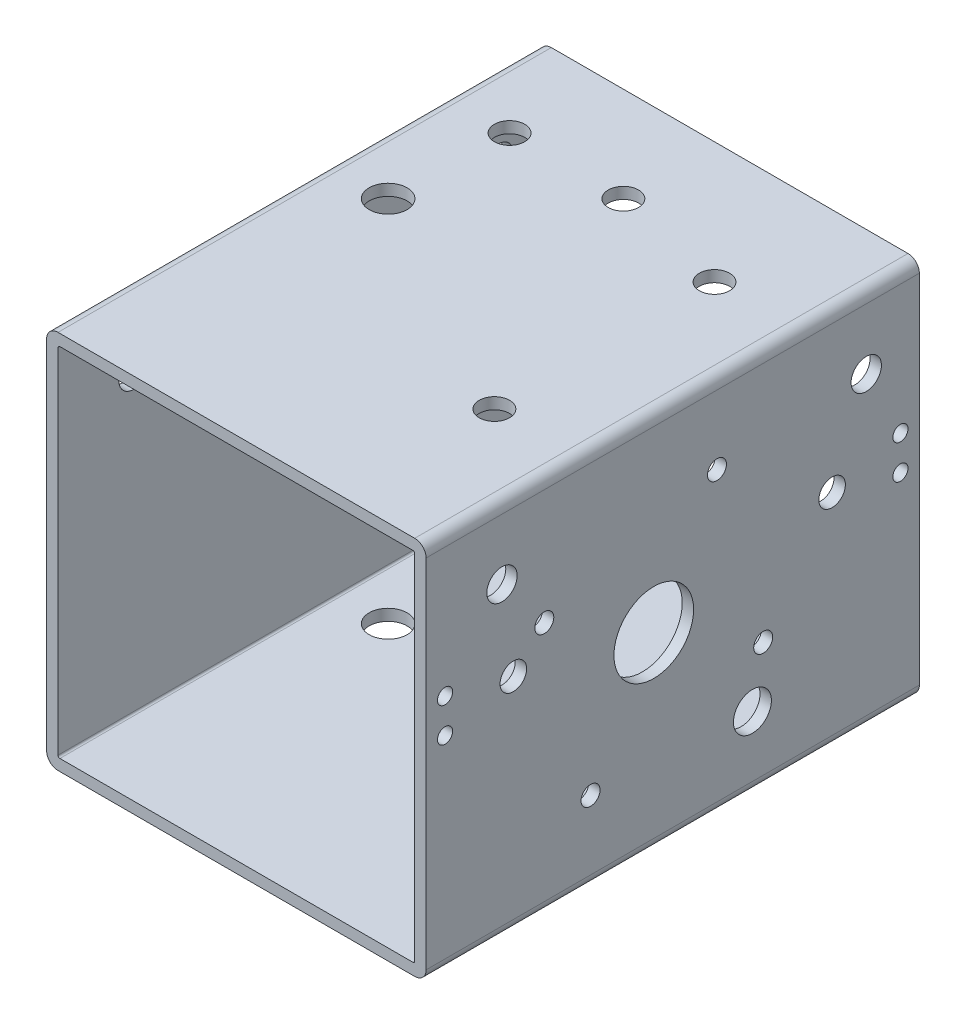
from build123d import *

# Parameters (mm, degrees)
SKETCH1_W                      = 100
SKETCH1_H                      = 100
SKETCH1_W_2                    = 94
SKETCH1_H_2                    = 94
EXTRUDE_THIN1_DEPTH            = 130
FILLET1_R                      = 0.5
FILLET2_R                      = 3
F_8_0_8_DIAMETER_HOLE2_D       = 8
F_8_0_8_DIAMETER_HOLE3_D       = 8
F_10_0_10_DIAMETER_HOLE1_D     = 10
F_10_0_10_DIAMETER_HOLE2_D     = 10
F_6_0_6_DIAMETER_HOLE1_D       = 6
F_6_0_6_DIAMETER_HOLE1_DEPTH   = 3
F_6_0_6_DIAMETER_HOLE2_D       = 6
F_6_0_6_DIAMETER_HOLE2_DEPTH   = 3
F_21_0_21_DIAMETER_HOLE1_D     = 21
F_21_0_21_DIAMETER_HOLE1_DEPTH = 3
F_5_0_5_DIAMETER_HOLE1_D       = 5
F_5_0_5_DIAMETER_HOLE1_DEPTH   = 3
F_8_0_8_DIAMETER_HOLE4_D       = 8
F_8_0_8_DIAMETER_HOLE4_DEPTH   = 3
CUT_EXTRUDE1_REACH             = 173.464
SKETCH31_R                     = 2
SKETCH31_R_2                   = 3.5
F_8_0_8_DIAMETER_HOLE5_D       = 8
F_8_0_8_DIAMETER_HOLE5_DEPTH   = 3


with BuildPart() as part:
    # Sketch1 → Extrude-Thin1 (new body)
    with BuildSketch(Plane.XY):
        Rectangle(SKETCH1_W, SKETCH1_H)
        Rectangle(SKETCH1_W_2, SKETCH1_H_2, mode=Mode.SUBTRACT)
    extrude(amount=EXTRUDE_THIN1_DEPTH)

    # Fillet1
    fillet1_edges = [part.edges().sort_by_distance(p)[0] for p in [
        (47, -47, 65),
        (47, 47, 65),
        (-47, 47, 65),
        (-47, -47, 65),
    ]]
    fillet(fillet1_edges, radius=FILLET1_R)

    # Fillet2
    fillet2_edges = [part.edges().sort_by_distance(p)[0] for p in [
        (50, -50, 65),
        (-50, -50, 65),
        (-50, 50, 65),
        (50, 50, 65),
    ]]
    fillet(fillet2_edges, radius=FILLET2_R)

    # Ø8.0 (8) Diameter Hole2 (through all)
    with Locations(Plane(origin=(0, 50, 0), x_dir=(1, 0, 0), z_dir=(0, 1, 0))):
        with Locations((28, -32), (28, -90)):
            Hole(F_8_0_8_DIAMETER_HOLE2_D / 2)

    # Ø8.0 (8) Diameter Hole3 (through all)
    with Locations(Plane(origin=(50, 0, 0), x_dir=(0, 0, -1), z_dir=(1, 0, 0))):
        with Locations((-14, 31), (-110, 31)):
            Hole(F_8_0_8_DIAMETER_HOLE3_D / 2)

    # Ø10.0 (10) Diameter Hole1 (through all)
    with Locations(Plane(origin=(0, 50, 0), x_dir=(1, 0, 0), z_dir=(0, 1, 0))):
        with Locations((-34, -56)):
            Hole(F_10_0_10_DIAMETER_HOLE1_D / 2)

    # Ø10.0 (10) Diameter Hole2 (through all)
    with Locations(Plane(origin=(50, 0, 0), x_dir=(0, 0, -1), z_dir=(1, 0, 0))):
        with Locations((-44, -31)):
            Hole(F_10_0_10_DIAMETER_HOLE2_D / 2)

    # Ø6.0 (6) Diameter Hole1
    with Locations(Plane.ZY.offset(50)):
        with Locations((56, -15), (56, 35)):
            Hole(F_6_0_6_DIAMETER_HOLE1_D / 2, depth=F_6_0_6_DIAMETER_HOLE1_DEPTH)

    # Ø6.0 (6) Diameter Hole2
    with Locations(Plane(origin=(0, -50, 0), x_dir=(-1, 0, 0), z_dir=(0, -1, 0))):
        with Locations((20, -44), (-35, -44)):
            Hole(F_6_0_6_DIAMETER_HOLE2_D / 2, depth=F_6_0_6_DIAMETER_HOLE2_DEPTH)

    # Ø21.0 (21) Diameter Hole1
    with Locations(Plane(origin=(50, 0, 0), x_dir=(0, 0, -1), z_dir=(1, 0, 0))):
        with Locations((-70, 0)):
            Hole(F_21_0_21_DIAMETER_HOLE1_D / 2, depth=F_21_0_21_DIAMETER_HOLE1_DEPTH)

    # Ø5.0 (5) Diameter Hole1
    with Locations(Plane(origin=(50, 0, 0), x_dir=(0, 0, -1), z_dir=(1, 0, 0))):
        with Locations((-41.157258279, -16.652364697), (-53.347635303, 28.842741721), (-98.842741721, 16.652364697), (-86.652364697, -28.842741721)):
            Hole(F_5_0_5_DIAMETER_HOLE1_D / 2, depth=F_5_0_5_DIAMETER_HOLE1_DEPTH)

    # Ø8.0 (8) Diameter Hole4
    with Locations(Plane(origin=(0, 50, 0), x_dir=(1, 0, 0), z_dir=(0, 1, 0))):
        with Locations((-3, -25)):
            Hole(F_8_0_8_DIAMETER_HOLE4_D / 2, depth=F_8_0_8_DIAMETER_HOLE4_DEPTH)

    # Sketch31 → Cut-Extrude1 (cut, up to next)
    with BuildSketch(Plane(origin=(50, 0, 0), x_dir=(0, 0, -1), z_dir=(1, 0, 0)), mode=Mode.PRIVATE) as cut_extrude1_sk1:
        with Locations(Location((-5, 4, 0), (0, 0, 90))):
            Circle(SKETCH31_R)
    cut_extrude1_tool1 = extrude(cut_extrude1_sk1.sketch, amount=-CUT_EXTRUDE1_REACH, mode=Mode.PRIVATE) & part.part
    # Sketch31 → Cut-Extrude1 (cut, up to next)
    with BuildSketch(Plane(origin=(50, 0, 0), x_dir=(0, 0, -1), z_dir=(1, 0, 0)), mode=Mode.PRIVATE) as cut_extrude1_sk2:
        with Locations(Location((-5, 13, 0), (0, 0, 90))):
            Circle(SKETCH31_R)
    cut_extrude1_tool2 = extrude(cut_extrude1_sk2.sketch, amount=-CUT_EXTRUDE1_REACH, mode=Mode.PRIVATE) & part.part
    # Sketch31 → Cut-Extrude1 (cut, up to next)
    with BuildSketch(Plane(origin=(50, 0, 0), x_dir=(0, 0, -1), z_dir=(1, 0, 0)), mode=Mode.PRIVATE) as cut_extrude1_sk3:
        with Locations(Location((-125, 13, 0), (0, 0, 90))):
            Circle(SKETCH31_R)
    cut_extrude1_tool3 = extrude(cut_extrude1_sk3.sketch, amount=-CUT_EXTRUDE1_REACH, mode=Mode.PRIVATE) & part.part
    # Sketch31 → Cut-Extrude1 (cut, up to next)
    with BuildSketch(Plane(origin=(50, 0, 0), x_dir=(0, 0, -1), z_dir=(1, 0, 0)), mode=Mode.PRIVATE) as cut_extrude1_sk4:
        with Locations(Location((-125, 4, 0), (0, 0, 90))):
            Circle(SKETCH31_R)
    cut_extrude1_tool4 = extrude(cut_extrude1_sk4.sketch, amount=-CUT_EXTRUDE1_REACH, mode=Mode.PRIVATE) & part.part
    # Sketch31 → Cut-Extrude1 (cut, up to next)
    with BuildSketch(Plane(origin=(50, 0, 0), x_dir=(0, 0, -1), z_dir=(1, 0, 0)), mode=Mode.PRIVATE) as cut_extrude1_sk5:
        with Locations(Location((-23, 8.5, 0), (0, 0, 90))):
            Circle(SKETCH31_R_2)
    cut_extrude1_tool5 = extrude(cut_extrude1_sk5.sketch, amount=-CUT_EXTRUDE1_REACH, mode=Mode.PRIVATE) & part.part
    # Sketch31 → Cut-Extrude1 (cut, up to next)
    with BuildSketch(Plane(origin=(50, 0, 0), x_dir=(0, 0, -1), z_dir=(1, 0, 0)), mode=Mode.PRIVATE) as cut_extrude1_sk6:
        with Locations(Location((-107, 8.5, 0), (0, 0, 90))):
            Circle(SKETCH31_R_2)
    cut_extrude1_tool6 = extrude(cut_extrude1_sk6.sketch, amount=-CUT_EXTRUDE1_REACH, mode=Mode.PRIVATE) & part.part
    add(cut_extrude1_tool1.solids().sort_by_distance((50, 4, 5))[0], mode=Mode.SUBTRACT)
    add(cut_extrude1_tool2.solids().sort_by_distance((50, 13, 5))[0], mode=Mode.SUBTRACT)
    add(cut_extrude1_tool3.solids().sort_by_distance((50, 13, 125))[0], mode=Mode.SUBTRACT)
    add(cut_extrude1_tool4.solids().sort_by_distance((50, 4, 125))[0], mode=Mode.SUBTRACT)
    add(cut_extrude1_tool5.solids().sort_by_distance((50, 8.5, 23))[0], mode=Mode.SUBTRACT)
    add(cut_extrude1_tool6.solids().sort_by_distance((50, 8.5, 107))[0], mode=Mode.SUBTRACT)

    # Ø8.0 (8) Diameter Hole5
    with Locations(Plane(origin=(0, 50, 0), x_dir=(1, 0, 0), z_dir=(0, 1, 0))):
        with Locations((-33, -25)):
            Hole(F_8_0_8_DIAMETER_HOLE5_D / 2, depth=F_8_0_8_DIAMETER_HOLE5_DEPTH)


solid = part.part
